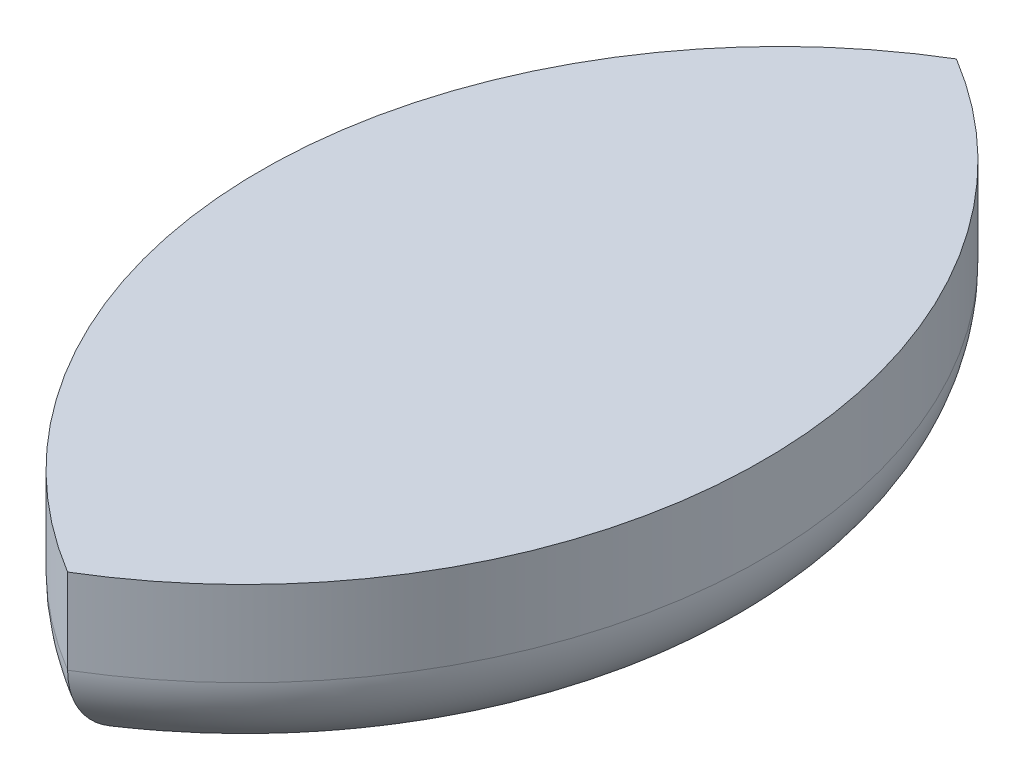
from build123d import *

# Parameters (mm, degrees)
BOSS_EXTRUDE1_DEPTH = 50.8
FILLET1_R           = 25.4


with BuildPart() as part:
    # Sketch1 → Boss-Extrude1 (new body)
    with BuildSketch(Plane(origin=(0, 0, 0), x_dir=(1, 0, 0), z_dir=(0, 1, 0))):
        with BuildLine():
            ThreePointArc((0, 132.7), (75, 0), (0, -132.7))
            ThreePointArc((0, -132.7), (-75, 0), (0, 132.7))
        make_face()
    extrude(amount=BOSS_EXTRUDE1_DEPTH)

    # Fillet1
    fillet1_edges = [part.edges().sort_by_distance(p)[0] for p in [
        (-75, 0, 0),
        (75, 0, 0),
    ]]
    fillet(fillet1_edges, radius=FILLET1_R)


solid = part.part
